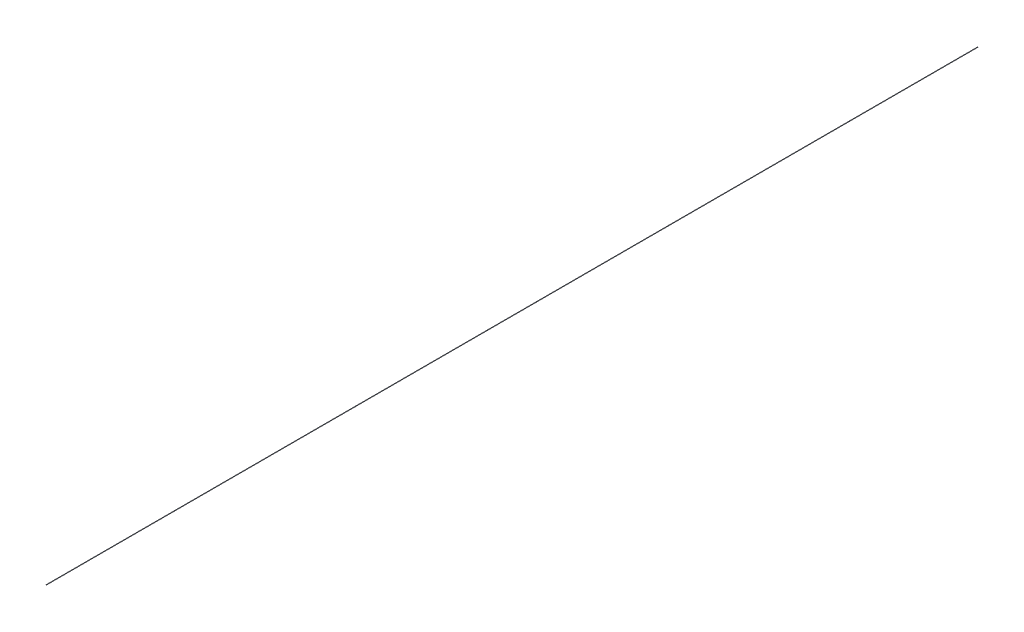
from build123d import *

# Parameters (mm, degrees)
SKETCH3_R           = 0.5
BOSS_EXTRUDE1_DEPTH = 1512.5
FILLET1_R           = 0.4


with BuildPart() as part:
    # Sketch3 → Boss-Extrude1 (new, symmetric)
    with BuildSketch(Plane.XY):
        Circle(SKETCH3_R)
    extrude(amount=BOSS_EXTRUDE1_DEPTH, both=True)

    # Fillet1
    fillet1_edges = [part.edges().sort_by_distance(p)[0] for p in [
        (-0.5, 0, -1512.5),
        (-0.5, 0, 1512.5),
    ]]
    fillet(fillet1_edges, radius=FILLET1_R)


solid = part.part
